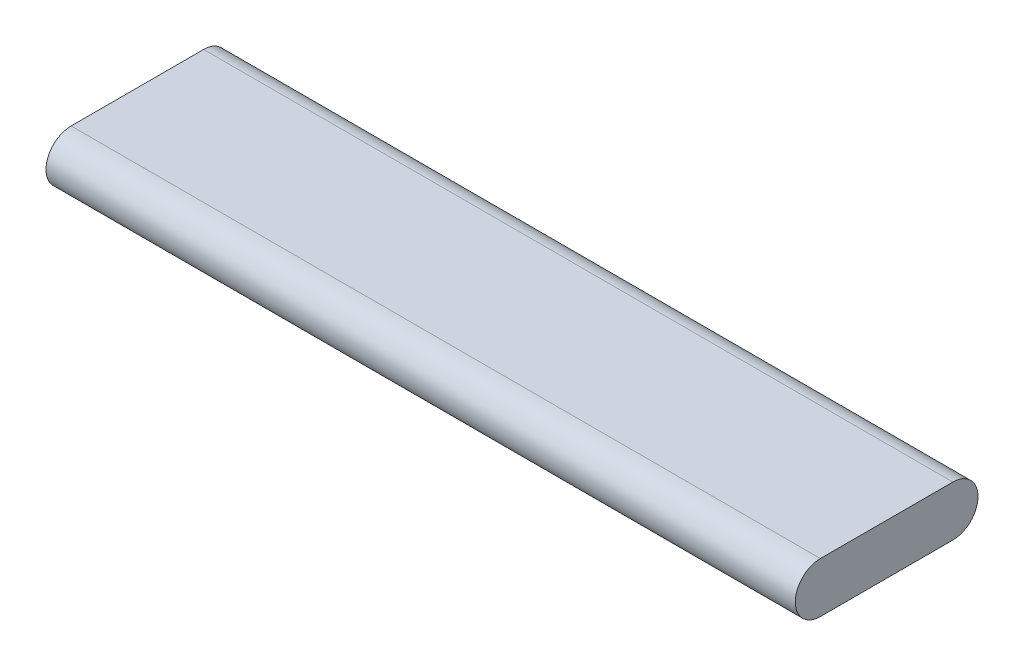
from build123d import *

# Parameters (mm, degrees)
SKETCH_1_W      = 82
SKETCH_1_H      = 20
EXTRUDE_1_DEPTH = 5.5
FILLET_1_RADIUS = 2.75
FILLET_1_LENGTH = 82
FILLET_2_RADIUS = 2.75
FILLET_2_LENGTH = 82


with BuildPart() as part:
    # 草图1 → 凸台-拉伸1 (new body)
    with BuildSketch(Plane(origin=(0, 0, 0), x_dir=(1, 0, 0), z_dir=(0, 1, 0))):
        with Locations((41, -10)):
            Rectangle(SKETCH_1_W, SKETCH_1_H)
    extrude(amount=EXTRUDE_1_DEPTH)

    # 圆角1: full round fillet: the end face becomes a half cylinder, R = half its width
    fillet_1_face = Plane((41, 2.75, 0), x_dir=(1, 0, 0), z_dir=(0, 0, -1))  # on the end face: x along it, z out of the body
    fillet_1_slab = fillet_1_face.offset(-FILLET_1_RADIUS / 2) * Box(FILLET_1_LENGTH, 2 * FILLET_1_RADIUS, FILLET_1_RADIUS, mode=Mode.PRIVATE)  # the body's end, R deep
    fillet_1_round = Plane((41, 2.75, 2.75), x_dir=(0, 0, -1), z_dir=(1, 0, 0)) * Cylinder(FILLET_1_RADIUS, FILLET_1_LENGTH, mode=Mode.PRIVATE)  # its axis R under the face
    add(fillet_1_slab - fillet_1_round, mode=Mode.SUBTRACT)

    # 圆角2: full round fillet: the end face becomes a half cylinder, R = half its width
    fillet_2_face = Plane((41, 2.75, 20), x_dir=(1, 0, 0), z_dir=(0, 0, 1))  # on the end face: x along it, z out of the body
    fillet_2_slab = fillet_2_face.offset(-FILLET_2_RADIUS / 2) * Box(FILLET_2_LENGTH, 2 * FILLET_2_RADIUS, FILLET_2_RADIUS, mode=Mode.PRIVATE)  # the body's end, R deep
    fillet_2_round = Plane((41, 2.75, 17.25), x_dir=(0, 0, 1), z_dir=(1, 0, 0)) * Cylinder(FILLET_2_RADIUS, FILLET_2_LENGTH, mode=Mode.PRIVATE)  # its axis R under the face
    add(fillet_2_slab - fillet_2_round, mode=Mode.SUBTRACT)


solid = part.part
